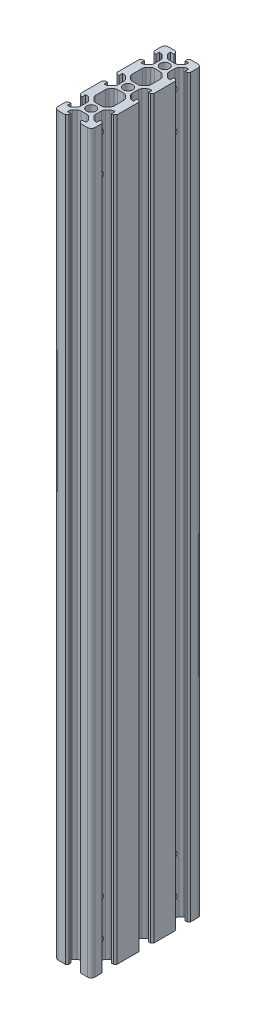
from build123d import *

# Parameters (mm, degrees)
SKETCH1_R           = 2.5
BOSS_EXTRUDE1_DEPTH = 400
SKETCH3_R           = 2.5
CUT_EXTRUDE1_DEPTH  = 405.969134626


with BuildPart() as part:
    # Sketch1 → Boss-Extrude1 (new body)
    with BuildSketch(Plane(origin=(0, 0, 0), x_dir=(1, 0, 0), z_dir=(0, 1, 0))):
        with BuildLine():
            Line((13.1, 59), (14.1, 60))
            Line((14.1, 60), (18, 60))
            ThreePointArc((18, 60), (19.414213562, 59.414213562), (20, 58))
            Line((20, 58), (20, 54.1))
            Line((20, 54.1), (19, 53.1))
            Line((19, 53.1), (18, 53.1))
            Line((18, 53.1), (18, 55))
            Line((18, 55), (17.242640687, 55))
            ThreePointArc((17.242640687, 55), (16.477273822, 54.847759065), (15.828427125, 54.414213562))
            Line((15.828427125, 54.414213562), (14.537854624, 53.123641061))
            ThreePointArc((14.537854624, 53.123641061), (14.104309121, 52.474794364), (13.952068186, 51.709427499))
            Line((13.952068186, 51.709427499), (13.952068186, 48.290572501))
            ThreePointArc((13.952068186, 48.290572501), (14.104309121, 47.525205636), (14.537854624, 46.876358939))
            Line((14.537854624, 46.876358939), (15.828427125, 45.585786438))
            ThreePointArc((15.828427125, 45.585786438), (16.477273822, 45.152240935), (17.242640687, 45))
            Line((17.242640687, 45), (18, 45))
            Line((18, 45), (18, 46.9))
            Line((18, 46.9), (19, 46.9))
            Line((19, 46.9), (20, 45.9))
            Line((20, 45.9), (20, 34.1))
            Line((20, 34.1), (19, 33.1))
            Line((19, 33.1), (18, 33.1))
            Line((18, 33.1), (18, 35))
            Line((18, 35), (17.242640687, 35))
            ThreePointArc((17.242640687, 35), (16.477273822, 34.847759065), (15.828427125, 34.414213562))
            Line((15.828427125, 34.414213562), (14.537854624, 33.123641061))
            ThreePointArc((14.537854624, 33.123641061), (14.104309121, 32.474794364), (13.952068186, 31.709427499))
            Line((13.952068186, 31.709427499), (13.952068186, 28.290572501))
            ThreePointArc((13.952068186, 28.290572501), (14.104309121, 27.525205636), (14.537854624, 26.876358939))
            Line((14.537854624, 26.876358939), (15.828427125, 25.585786438))
            ThreePointArc((15.828427125, 25.585786438), (16.477273822, 25.152240935), (17.242640687, 25))
            Line((17.242640687, 25), (18, 25))
            Line((18, 25), (18, 26.9))
            Line((18, 26.9), (19, 26.9))
            Line((19, 26.9), (20, 25.9))
            Line((20, 25.9), (20, 14.1))
            Line((20, 14.1), (19, 13.1))
            Line((19, 13.1), (18, 13.1))
            Line((18, 13.1), (18, 15))
            Line((18, 15), (17.242640687, 15))
            ThreePointArc((17.242640687, 15), (16.477273822, 14.847759065), (15.828427125, 14.414213562))
            Line((15.828427125, 14.414213562), (14.537854624, 13.123641061))
            ThreePointArc((14.537854624, 13.123641061), (14.104309121, 12.474794364), (13.952068186, 11.709427499))
            Line((13.952068186, 11.709427499), (13.952068186, 8.290572501))
            ThreePointArc((13.952068186, 8.290572501), (14.104309121, 7.525205636), (14.537854624, 6.876358939))
            Line((14.537854624, 6.876358939), (15.828427125, 5.585786438))
            ThreePointArc((15.828427125, 5.585786438), (16.477273822, 5.152240935), (17.242640687, 5))
            Line((17.242640687, 5), (18, 5))
            Line((18, 5), (18, 6.9))
            Line((18, 6.9), (19, 6.9))
            Line((19, 6.9), (20, 5.9))
            Line((20, 5.9), (20, 2))
            ThreePointArc((20, 2), (19.414213562, 0.585786438), (18, 0))
            Line((18, 0), (14.1, 0))
            Line((14.1, 0), (13.1, 1))
            Line((13.1, 1), (13.1, 2))
            Line((13.1, 2), (15, 2))
            Line((15, 2), (15, 2.757359313))
            ThreePointArc((15, 2.757359313), (14.847759065, 3.522726178), (14.414213562, 4.171572875))
            Line((14.414213562, 4.171572875), (13.123641061, 5.462145376))
            ThreePointArc((13.123641061, 5.462145376), (12.474794364, 5.895690879), (11.709427499, 6.047931814))
            Line((11.709427499, 6.047931814), (8.290572501, 6.047931814))
            ThreePointArc((8.290572501, 6.047931814), (7.525205636, 5.895690879), (6.876358939, 5.462145376))
            Line((6.876358939, 5.462145376), (5.585786438, 4.171572875))
            ThreePointArc((5.585786438, 4.171572875), (5.152240935, 3.522726178), (5, 2.757359313))
            Line((5, 2.757359313), (5, 2))
            Line((5, 2), (6.9, 2))
            Line((6.9, 2), (6.9, 1))
            Line((6.9, 1), (5.9, 0))
            Line((5.9, 0), (2, 0))
            ThreePointArc((2, 0), (0.585786438, 0.585786438), (0, 2))
            Line((0, 2), (0, 5.9))
            Line((0, 5.9), (1, 6.9))
            Line((1, 6.9), (2, 6.9))
            Line((2, 6.9), (2, 5))
            Line((2, 5), (2.757359313, 5))
            ThreePointArc((2.757359313, 5), (3.522726178, 5.152240935), (4.171572875, 5.585786438))
            Line((4.171572875, 5.585786438), (5.462145376, 6.876358939))
            ThreePointArc((5.462145376, 6.876358939), (5.895690879, 7.525205636), (6.047931814, 8.290572501))
            Line((6.047931814, 8.290572501), (6.047931814, 11.709427499))
            ThreePointArc((6.047931814, 11.709427499), (5.895690879, 12.474794364), (5.462145376, 13.123641061))
            Line((5.462145376, 13.123641061), (4.171572875, 14.414213562))
            ThreePointArc((4.171572875, 14.414213562), (3.522726178, 14.847759065), (2.757359313, 15))
            Line((2.757359313, 15), (2, 15))
            Line((2, 15), (2, 13.1))
            Line((2, 13.1), (1, 13.1))
            Line((1, 13.1), (0, 14.1))
            Line((0, 14.1), (0, 25.9))
            Line((0, 25.9), (1, 26.9))
            Line((1, 26.9), (2, 26.9))
            Line((2, 26.9), (2, 25))
            Line((2, 25), (2.757359313, 25))
            ThreePointArc((2.757359313, 25), (3.522726178, 25.152240935), (4.171572875, 25.585786438))
            Line((4.171572875, 25.585786438), (5.462145376, 26.876358939))
            ThreePointArc((5.462145376, 26.876358939), (5.895690879, 27.525205636), (6.047931814, 28.290572501))
            Line((6.047931814, 28.290572501), (6.047931814, 31.709427499))
            ThreePointArc((6.047931814, 31.709427499), (5.895690879, 32.474794364), (5.462145376, 33.123641061))
            Line((5.462145376, 33.123641061), (4.171572875, 34.414213562))
            ThreePointArc((4.171572875, 34.414213562), (3.522726178, 34.847759065), (2.757359313, 35))
            Line((2.757359313, 35), (2, 35))
            Line((2, 35), (2, 33.1))
            Line((2, 33.1), (1, 33.1))
            Line((1, 33.1), (0, 34.1))
            Line((0, 34.1), (0, 45.9))
            Line((0, 45.9), (1, 46.9))
            Line((1, 46.9), (2, 46.9))
            Line((2, 46.9), (2, 45))
            Line((2, 45), (2.757359313, 45))
            ThreePointArc((2.757359313, 45), (3.522726178, 45.152240935), (4.171572875, 45.585786438))
            Line((4.171572875, 45.585786438), (5.462145376, 46.876358939))
            ThreePointArc((5.462145376, 46.876358939), (5.895690879, 47.525205636), (6.047931814, 48.290572501))
            Line((6.047931814, 48.290572501), (6.047931814, 51.709427499))
            ThreePointArc((6.047931814, 51.709427499), (5.895690879, 52.474794364), (5.462145376, 53.123641061))
            Line((5.462145376, 53.123641061), (4.171572875, 54.414213562))
            ThreePointArc((4.171572875, 54.414213562), (3.522726178, 54.847759065), (2.757359313, 55))
            Line((2.757359313, 55), (2, 55))
            Line((2, 55), (2, 53.1))
            Line((2, 53.1), (1, 53.1))
            Line((1, 53.1), (0, 54.1))
            Line((0, 54.1), (0, 58))
            ThreePointArc((0, 58), (0.585786438, 59.414213562), (2, 60))
            Line((2, 60), (5.9, 60))
            Line((5.9, 60), (6.9, 59))
            Line((6.9, 59), (6.9, 58))
            Line((6.9, 58), (5, 58))
            Line((5, 58), (5, 57.242640687))
            ThreePointArc((5, 57.242640687), (5.152240935, 56.477273822), (5.585786438, 55.828427125))
            Line((5.585786438, 55.828427125), (6.876358939, 54.537854624))
            ThreePointArc((6.876358939, 54.537854624), (7.525205636, 54.104309121), (8.290572501, 53.952068186))
            Line((8.290572501, 53.952068186), (11.709427499, 53.952068186))
            ThreePointArc((11.709427499, 53.952068186), (12.474794364, 54.104309121), (13.123641061, 54.537854624))
            Line((13.123641061, 54.537854624), (14.414213562, 55.828427125))
            ThreePointArc((14.414213562, 55.828427125), (14.847759065, 56.477273822), (15, 57.242640687))
            Line((15, 57.242640687), (15, 58))
            Line((15, 58), (13.1, 58))
            Line((13.1, 58), (13.1, 59))
        make_face()
        with Locations(Location((10, 10, 0), (0, 0, 270))):
            Circle(SKETCH1_R, mode=Mode.SUBTRACT)
        with Locations(Location((10, 30, 0), (0, 0, 270))):
            Circle(SKETCH1_R, mode=Mode.SUBTRACT)
        with Locations(Location((10, 50, 0), (0, 0, 270))):
            Circle(SKETCH1_R, mode=Mode.SUBTRACT)
        with BuildLine():
            Line((14.414213562, 15.828427125), (13.123641061, 14.537854624))
            ThreePointArc((13.123641061, 14.537854624), (12.474794364, 14.104309121), (11.709427499, 13.952068186))
            Line((11.709427499, 13.952068186), (8.290572501, 13.952068186))
            ThreePointArc((8.290572501, 13.952068186), (7.525205636, 14.104309121), (6.876358939, 14.537854624))
            Line((6.876358939, 14.537854624), (5.585786438, 15.828427125))
            ThreePointArc((5.585786438, 15.828427125), (5.152240935, 16.477273822), (5, 17.242640687))
            Line((5, 17.242640687), (5, 22.757359313))
            ThreePointArc((5, 22.757359313), (5.152240935, 23.522726178), (5.585786438, 24.171572875))
            Line((5.585786438, 24.171572875), (6.876358939, 25.462145376))
            ThreePointArc((6.876358939, 25.462145376), (7.525205636, 25.895690879), (8.290572501, 26.047931814))
            Line((8.290572501, 26.047931814), (11.709427499, 26.047931814))
            ThreePointArc((11.709427499, 26.047931814), (12.474794364, 25.895690879), (13.123641061, 25.462145376))
            Line((13.123641061, 25.462145376), (14.414213562, 24.171572875))
            ThreePointArc((14.414213562, 24.171572875), (14.847759065, 23.522726178), (15, 22.757359313))
            Line((15, 22.757359313), (15, 17.242640687))
            ThreePointArc((15, 17.242640687), (14.847759065, 16.477273822), (14.414213562, 15.828427125))
        make_face(mode=Mode.SUBTRACT)
        with BuildLine():
            Line((15, 37.242640687), (15, 42.757359313))
            ThreePointArc((15, 42.757359313), (14.847759065, 43.522726178), (14.414213562, 44.171572875))
            Line((14.414213562, 44.171572875), (13.123641061, 45.462145376))
            ThreePointArc((13.123641061, 45.462145376), (12.474794364, 45.895690879), (11.709427499, 46.047931814))
            Line((11.709427499, 46.047931814), (8.290572501, 46.047931814))
            ThreePointArc((8.290572501, 46.047931814), (7.525205636, 45.895690879), (6.876358939, 45.462145376))
            Line((6.876358939, 45.462145376), (5.585786438, 44.171572875))
            ThreePointArc((5.585786438, 44.171572875), (5.152240935, 43.522726178), (5, 42.757359313))
            Line((5, 42.757359313), (5, 37.242640687))
            ThreePointArc((5, 37.242640687), (5.152240935, 36.477273822), (5.585786438, 35.828427125))
            Line((5.585786438, 35.828427125), (6.876358939, 34.537854624))
            ThreePointArc((6.876358939, 34.537854624), (7.525205636, 34.104309121), (8.290572501, 33.952068186))
            Line((8.290572501, 33.952068186), (11.709427499, 33.952068186))
            ThreePointArc((11.709427499, 33.952068186), (12.474794364, 34.104309121), (13.123641061, 34.537854624))
            Line((13.123641061, 34.537854624), (14.414213562, 35.828427125))
            ThreePointArc((14.414213562, 35.828427125), (14.847759065, 36.477273822), (15, 37.242640687))
        make_face(mode=Mode.SUBTRACT)
    extrude(amount=BOSS_EXTRUDE1_DEPTH)

    # Sketch3 → Cut-Extrude1 (cut, through all)
    with BuildSketch(Plane.ZY):
        with Locations((-50, 390)):
            Circle(SKETCH3_R)
        with Locations((-10, 390)):
            Circle(SKETCH3_R)
        with Locations((-50, 370)):
            Circle(SKETCH3_R)
        with Locations((-10, 370)):
            Circle(SKETCH3_R)
        with Locations((-10, 30)):
            Circle(SKETCH3_R)
        with Locations((-50, 30)):
            Circle(SKETCH3_R)
        with Locations((-10, 10)):
            Circle(SKETCH3_R)
        with Locations((-50, 10)):
            Circle(SKETCH3_R)
    extrude(amount=-CUT_EXTRUDE1_DEPTH, mode=Mode.SUBTRACT)


solid = part.part
